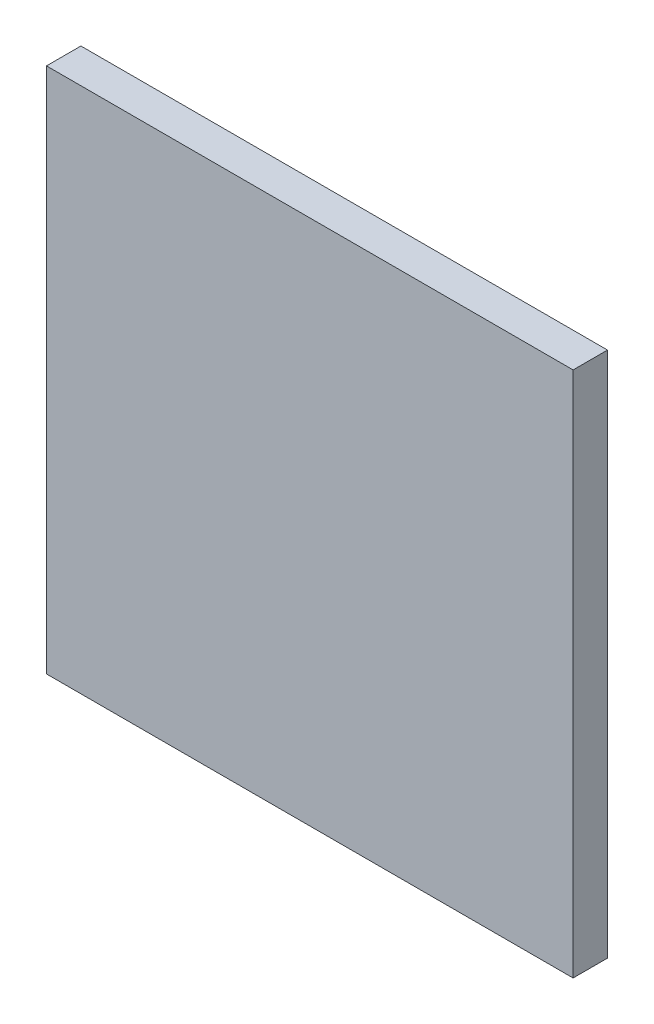
from build123d import *

# Parameters (mm, degrees)
SKETCH1_W           = 101
SKETCH1_H           = 101
BOSS_EXTRUDE1_DEPTH = 6.6


with BuildPart() as part:
    # Sketch1 → Boss-Extrude1 (new body)
    with BuildSketch(Plane.XY):
        with Locations((17.496062992, -15.507874016)):
            Rectangle(SKETCH1_W, SKETCH1_H)
    extrude(amount=BOSS_EXTRUDE1_DEPTH)


solid = part.part
